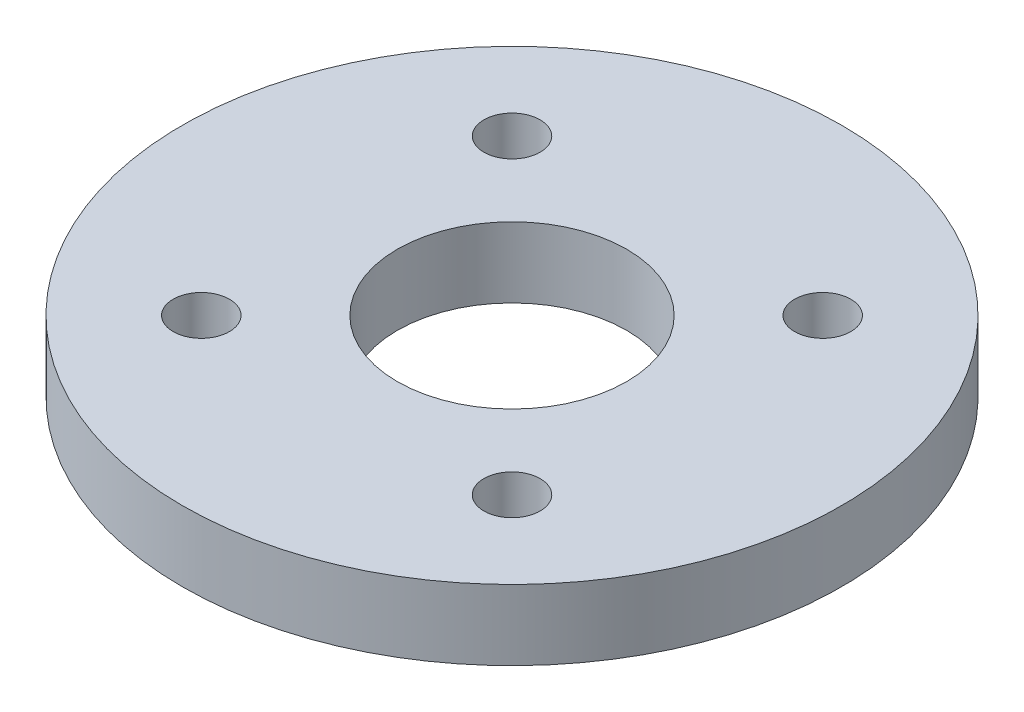
from build123d import *

# Parameters (mm, degrees)
SKETCH1_R           = 18.75
SKETCH1_R_2         = 1.6
SKETCH1_R_3         = 6.525
BOSS_EXTRUDE1_DEPTH = 4


with BuildPart() as part:
    # Sketch1 → Boss-Extrude1 (new body)
    with BuildSketch(Plane(origin=(0, 0, 0), x_dir=(1, 0, 0), z_dir=(0, 1, 0))):
        with Locations(Location((0, 0, 0), (0, 0, 270))):
            Circle(SKETCH1_R)
        with Locations(Location((-8.838834765, 8.838834765, 0), (0, 0, 270))):
            Circle(SKETCH1_R_2, mode=Mode.SUBTRACT)
        with Locations(Location((-8.838834765, -8.838834765, 0), (0, 0, 270))):
            Circle(SKETCH1_R_2, mode=Mode.SUBTRACT)
        with Locations(Location((8.838834765, -8.838834765, 0), (0, 0, 270))):
            Circle(SKETCH1_R_2, mode=Mode.SUBTRACT)
        with Locations(Location((8.838834765, 8.838834765, 0), (0, 0, 270))):
            Circle(SKETCH1_R_2, mode=Mode.SUBTRACT)
        with Locations(Location((0, 0, 0), (0, 0, 270))):
            Circle(SKETCH1_R_3, mode=Mode.SUBTRACT)
    extrude(amount=BOSS_EXTRUDE1_DEPTH)


solid = part.part
